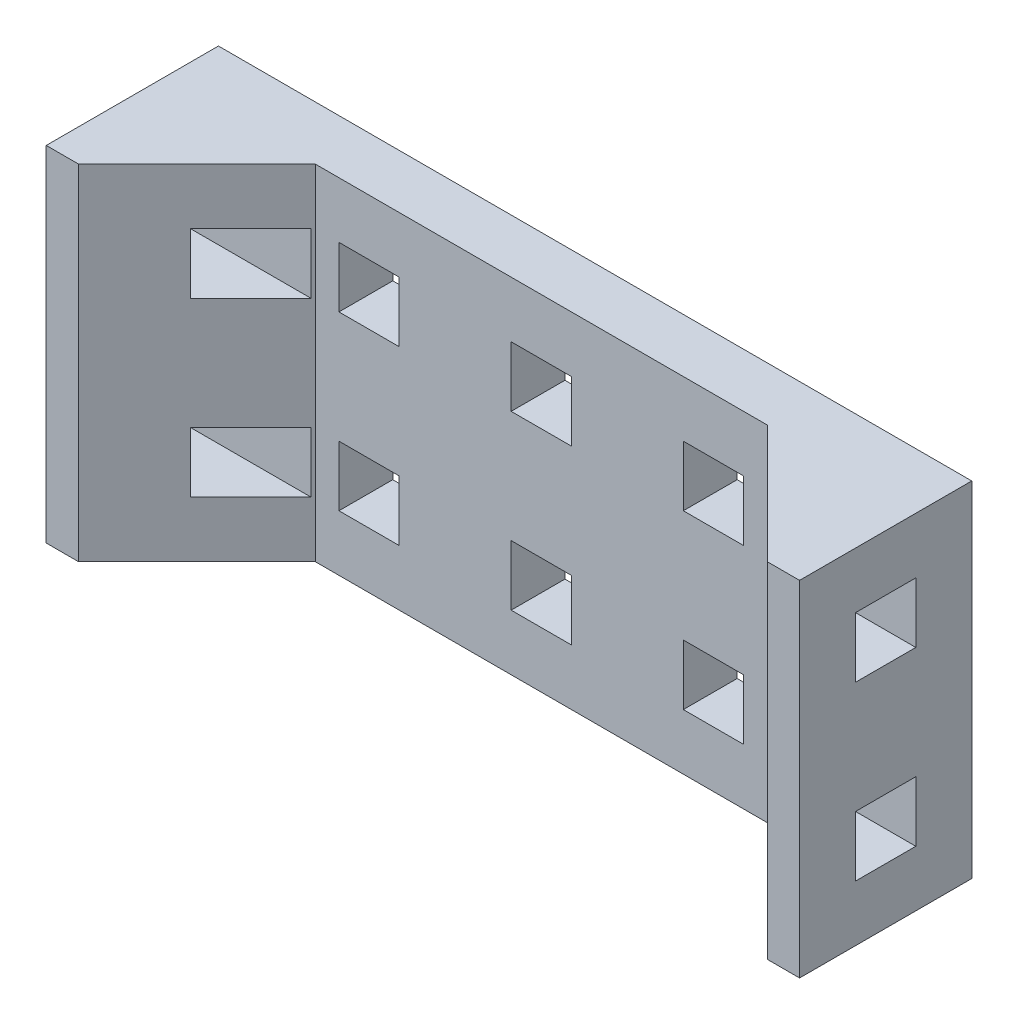
from build123d import *

# Parameters (mm, degrees)
RESSALTO_EXTRUS_O1_DEPTH  = 16
ESBO_O2_W                 = 2.8
ESBO_O2_H                 = 2.8
CORTE_EXTRUS_O1_DEPTH     = 54.103672189
ESBO_O4_W                 = 2.8
ESBO_O4_H                 = 2.8
CORTE_EXTRUS_O2_DEPTH     = 31.186917696
CORPO_MOVER_COPIAR1_ANGLE = 90
ESBO_O6_W                 = 32.5
ESBO_O6_H                 = 16
CORTE_EXTRUS_O3_DEPTH     = 29.861739379
ESBO_O7_W                 = 25.221413321
ESBO_O7_H                 = 12.57615678
RESSALTO_EXTRUS_O2_DEPTH  = 2.5
ESBO_O8_W                 = 2.8
ESBO_O8_H                 = 2.8
CORTE_EXTRUS_O4_DEPTH     = 29.271009886


with BuildPart() as part:
    # Esboço1 → Ressalto-extrusão1 (new body)
    with BuildSketch(Plane.XY):
        Polygon((-25, 0), (25, 0), (25, 8), (23.5, 8), (18, 2.5), (-18, 2.5), (-23.5, 8), (-25, 8), align=None)
    extrude(amount=RESSALTO_EXTRUS_O1_DEPTH)

    # Esboço2 → Corte-extrusão1 (cut, through all)
    with BuildSketch(Plane(origin=(25, 0, 0), x_dir=(0, 0, -1), z_dir=(1, 0, 0))):
        with Locations((-4, 4)):
            Rectangle(ESBO_O2_W, ESBO_O2_H)
        with Locations((-12, 4)):
            Rectangle(ESBO_O2_W, ESBO_O2_H)
    extrude(amount=-CORTE_EXTRUS_O1_DEPTH, mode=Mode.SUBTRACT)

    # Esboço4 → Corte-extrusão2 (cut, through all)
    with BuildSketch(Plane(origin=(0, 2.5, 0), x_dir=(1, 0, 0), z_dir=(0, 1, 0))):
        with Locations((-16, -4)):
            Rectangle(ESBO_O4_W, ESBO_O4_H)
        with Locations((-8, -4)):
            Rectangle(ESBO_O4_W, ESBO_O4_H)
        with Locations((0, -4)):
            Rectangle(ESBO_O4_W, ESBO_O4_H)
        with Locations((8, -4)):
            Rectangle(ESBO_O4_W, ESBO_O4_H)
        with Locations((16, -4)):
            Rectangle(ESBO_O4_W, ESBO_O4_H)
        with Locations((-8, -12)):
            Rectangle(ESBO_O4_W, ESBO_O4_H)
        with Locations((0, -12)):
            Rectangle(ESBO_O4_W, ESBO_O4_H)
        with Locations((8, -12)):
            Rectangle(ESBO_O4_W, ESBO_O4_H)
        with Locations((16, -12)):
            Rectangle(ESBO_O4_W, ESBO_O4_H)
        with Locations((-16, -12)):
            Rectangle(ESBO_O4_W, ESBO_O4_H)
    extrude(amount=-CORTE_EXTRUS_O2_DEPTH, mode=Mode.SUBTRACT)


with BuildPart() as part_1:
    # Corpo-Mover/Copiar1: moved
    add(part.part.rotate(Axis((0, 4, 8), (1, 0, 0)), CORPO_MOVER_COPIAR1_ANGLE))

    # Esboço6 → Corte-extrusão3 (cut, through all)
    with BuildSketch(Plane(origin=(0, 0, 4), x_dir=(-1, 0, 0), z_dir=(0, 0, -1))):
        with Locations((-8.75, 4)):
            Rectangle(ESBO_O6_W, ESBO_O6_H)
    extrude(amount=-CORTE_EXTRUS_O3_DEPTH, mode=Mode.SUBTRACT)

    # Espelhar3: part across plane


with BuildPart() as part_2:
    add(part_1.part)
    add(part_1.part.mirror(Plane(origin=(-7.5, -4, 12), x_dir=(0, 0, 1), z_dir=(-1, 0, 0))))

    # Esboço7 → Ressalto-extrusão2 (add, through all)
    with BuildSketch(Plane.XY.offset(6.5)):
        with Locations((-4.971284079, 3.626460754)):
            Rectangle(ESBO_O7_W, ESBO_O7_H)
    extrude(amount=-RESSALTO_EXTRUS_O2_DEPTH)

    # Esboço8 → Corte-extrusão4 (cut, through all)
    with BuildSketch(Plane.XY.offset(6.5)):
        with Locations((-7.5, 8)):
            Rectangle(ESBO_O8_W, ESBO_O8_H)
        with Locations((-15.5, 8)):
            Rectangle(ESBO_O8_W, ESBO_O8_H)
        with Locations((0.5, 8)):
            Rectangle(ESBO_O8_W, ESBO_O8_H)
        with Locations((-7.5, 0)):
            Rectangle(ESBO_O8_W, ESBO_O8_H)
        with Locations((0.5, 0)):
            Rectangle(ESBO_O8_W, ESBO_O8_H)
        with Locations((-15.5, 0)):
            Rectangle(ESBO_O8_W, ESBO_O8_H)
    extrude(amount=-CORTE_EXTRUS_O4_DEPTH, mode=Mode.SUBTRACT)


solid = part_2.part
